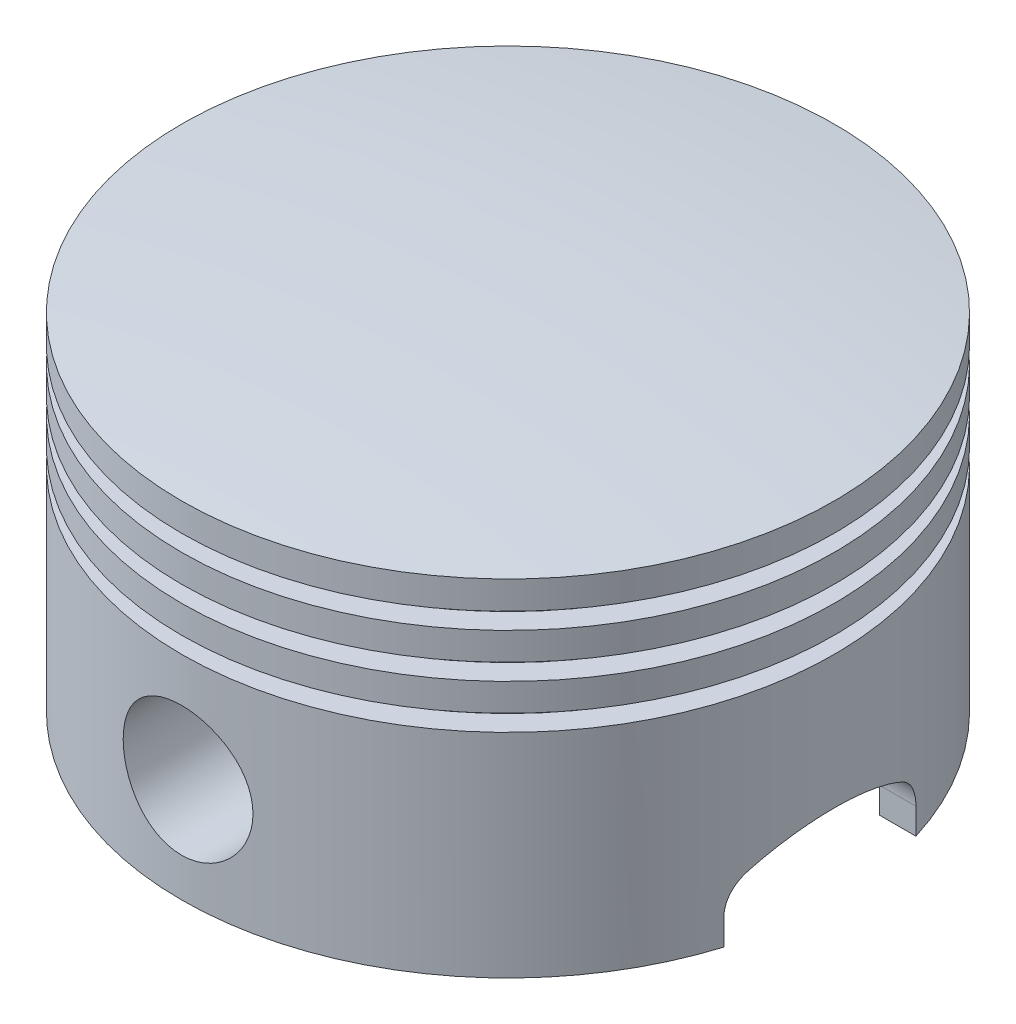
from build123d import *

# Parameters (mm, degrees)
SKETCH1_R                = 85
BOSS_EXTRUDE3_DEPTH      = 90
CUT_EXTRUDE3_START       = -7.3
SKETCH4_OUTSIDE_W        = 223.342
SKETCH4_OUTSIDE_H        = 223.342
SKETCH4_OUTSIDE_R        = 79
CUT_EXTRUDE3_DEPTH       = 4.3
LPATTERN1_COUNT          = 3
LPATTERN1_PITCH          = 11.5
SKETCH5_R                = 76
CUT_EXTRUDE4_DEPTH       = 85
DOME1_FACE_RADIUS        = 85
DOME1_HEIGHT             = 5
SKETCH7_R                = 16.9
CUT_EXTRUDE5_DEPTH       = 151.166574177
CUT_EXTRUDE6_DEPTH       = 151.16657435
CUT_EXTRUDE6_DEPTH_BACK  = 151.16657435
FILLET1_R                = 10
BOSS_EXTRUDE4_REACH      = 171.167
BOSS_EXTRUDE4_END_RADIUS = 76
BOSS_EXTRUDE4_START      = 19
SKETCH9_R                = 22.5
SKETCH9_R_2              = 16.9


with BuildPart() as part:
    # Sketch1 → Boss-Extrude3 (new body)
    with BuildSketch(Plane(origin=(0, 0, 0), x_dir=(1, 0, 0), z_dir=(0, 1, 0))):
        with Locations(Location((0, 0, 0), (0, 0, 270))):
            Circle(SKETCH1_R)
    extrude(amount=-BOSS_EXTRUDE3_DEPTH)

    # Sketch4 outside → Cut-Extrude3 (cut)
    with BuildSketch(Plane(origin=(0, 0, 0), x_dir=(1, 0, 0), z_dir=(0, 1, 0)).offset(CUT_EXTRUDE3_START)):
        Rectangle(SKETCH4_OUTSIDE_W, SKETCH4_OUTSIDE_H)
        with Locations(Location((0, 0, 0), (0, 0, 270))):
            Circle(SKETCH4_OUTSIDE_R, mode=Mode.SUBTRACT)
    cut_extrude3 = extrude(amount=-CUT_EXTRUDE3_DEPTH, mode=Mode.SUBTRACT)

    # LPattern1: Cut-Extrude3 ×3
    with Locations(*[(0, -i * LPATTERN1_PITCH, 0) for i in range(1, LPATTERN1_COUNT)]):
        add(cut_extrude3, mode=Mode.SUBTRACT)

    # Sketch5 → Cut-Extrude4 (cut)
    with BuildSketch(Plane.XZ.offset(90)):
        with Locations(Location((0, 0, 0), (0, 0, 270))):
            Circle(SKETCH5_R)
    extrude(amount=-CUT_EXTRUDE4_DEPTH, mode=Mode.SUBTRACT)

    # Dome1: a dome of height H over a round flat face of radius A is a cap of a sphere of radius (A * A + H * H) / (2 * H)
    dome1_r = (DOME1_FACE_RADIUS * DOME1_FACE_RADIUS + DOME1_HEIGHT * DOME1_HEIGHT) / (2 * DOME1_HEIGHT)
    dome1_base = Plane((0, 0, 0), z_dir=(0, 1, 0))
    with Locations(dome1_base.offset(DOME1_HEIGHT - dome1_r)):
        dome1_ball = Sphere(dome1_r, mode=Mode.PRIVATE)
    add(split(dome1_ball, bisect_by=dome1_base, keep=Keep.TOP, mode=Mode.PRIVATE))

    # Sketch7 → Cut-Extrude5 (cut, symmetric)
    with BuildSketch(Plane.XY):
        with Locations((0, -63)):
            Circle(SKETCH7_R)
    cut_extrude5 = extrude(amount=CUT_EXTRUDE5_DEPTH, both=True, mode=Mode.SUBTRACT)

    # Sketch8 → Cut-Extrude6 (cut, two sides: drawn at the far end of the back side and taken through both)
    with BuildSketch(Plane(origin=(0, 0, 0), x_dir=(0, 0, -1), z_dir=(1, 0, 0)).offset(-CUT_EXTRUDE6_DEPTH_BACK)):
        with BuildLine():
            Line((-25, -90), (-25, -78))
            ThreePointArc((-25, -78), (0, -69.224989992), (25, -78))
            Line((25, -78), (25, -90))
            Line((25, -90), (-25, -90))
        make_face()
    extrude(amount=CUT_EXTRUDE6_DEPTH + CUT_EXTRUDE6_DEPTH_BACK, mode=Mode.SUBTRACT)

    # Fillet1
    fillet1_edges = [part.edges().sort_by_distance(p)[0] for p in [
        (76.505425755, -78, -25),
        (-76.505425755, -78, -25),
        (76.505425755, -78, 25),
        (-76.505425755, -78, 25),
    ]]
    fillet(fillet1_edges, radius=FILLET1_R)

    # Boss-Extrude4: up to this cylinder (the profile starts inside it)
    boss_extrude4_end = Plane(origin=(0, -63, 0), z_dir=(0, -1, 0)) * Cylinder(BOSS_EXTRUDE4_END_RADIUS, 495.334, mode=Mode.PRIVATE)
    # Sketch9 → Boss-Extrude4 (add, up to the surface)
    with BuildSketch(Plane.XY.offset(BOSS_EXTRUDE4_START), mode=Mode.PRIVATE) as boss_extrude4_sk1:
        with Locations(Location((0, -63, 0), (0, 0, 180))):
            Circle(SKETCH9_R)
        with Locations((0, -63)):
            Circle(SKETCH9_R_2, mode=Mode.SUBTRACT)
    boss_extrude4_tool1 = extrude(boss_extrude4_sk1.sketch, amount=BOSS_EXTRUDE4_REACH, mode=Mode.PRIVATE) & boss_extrude4_end
    boss_extrude4 = boss_extrude4_tool1.solids().sort_by_distance((21.863604, -63, 19))[0]
    add(boss_extrude4)

    # Mirror1: Cut-Extrude5 across plane
    add(cut_extrude5.mirror(Plane.XY), mode=Mode.SUBTRACT)

    # Mirror2: Cut-Extrude5 across plane
    add(cut_extrude5.mirror(Plane.XY), mode=Mode.SUBTRACT)

    # Mirror3: Cut-Extrude5, Boss-Extrude4 across plane
    add(cut_extrude5.mirror(Plane.XY), mode=Mode.SUBTRACT)
    add(boss_extrude4.mirror(Plane.XY))


solid = part.part
